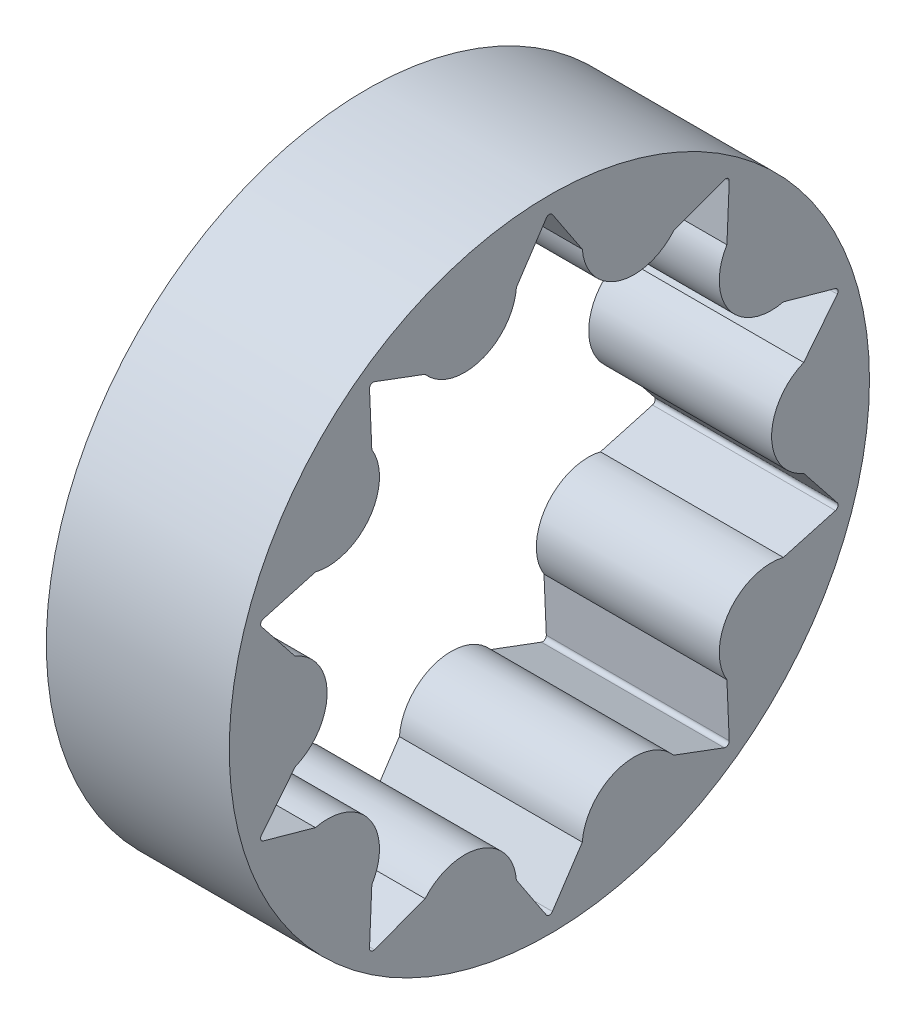
from build123d import *

# Parameters (mm, degrees)
BOSS_EXTRUDE1_DEPTH     = 5.3
CIRPATTERN1_COUNT       = 10
FILLET1_R               = 0.2
FILLET3_R               = 0.2
SKETCH2_R               = 10
SKETCH2_R_2             = 4.05
BOSS_EXTRUDE2_DEPTH     = 16.7
CUT_EXTRUDE1_DEPTH      = 29.341701561
CUT_EXTRUDE1_DEPTH_BACK = 29.341701561
SKETCH2_2_R             = 4.05
SKETCH3_R               = 17.5
BOSS_EXTRUDE3_DEPTH     = 10
SKETCH3_3_R             = 17.5
CUT_EXTRUDE2_DEPTH      = 34.11344138


with BuildPart() as part:
    # Sketch1 → Boss-Extrude1 (new body)
    with BuildSketch(Plane(origin=(0, 0, 0), x_dir=(0, 0, -1), z_dir=(1, 0, 0))):
        with BuildLine():
            Line((0, 0), (9.845402976, 13.551034656))
            Line((9.845402976, 13.551034656), (6.793214092, 12.412684734))
            ThreePointArc((6.793214092, 12.412684734), (3.754556482, 11.555336673), (1.800167381, 14.035023954))
            Line((1.800167381, 14.035023954), (0, 16.75))
            Line((0, 16.75), (0, 0))
        make_face()
    boss_extrude1 = extrude(amount=BOSS_EXTRUDE1_DEPTH)

    # CirPattern1: Boss-Extrude1 ×10 about axis
    cirpattern1_axis = Axis((5.3, 0, 0), (-1, 0, 0))
    for i in range(1, CIRPATTERN1_COUNT):
        add(boss_extrude1.rotate(cirpattern1_axis, i * 360 / CIRPATTERN1_COUNT))

    # Fillet1
    fillet1_edges = [part.edges().sort_by_distance(p)[0] for p in [
        (2.65, 16.75, 0),
    ]]
    fillet(fillet1_edges, radius=FILLET1_R)

    # Fillet3
    fillet3_edges = [part.edges().sort_by_distance(p)[0] for p in [
        (2.65, 13.551034656, 9.845402976),
        (2.65, 5.176034656, 15.930196648),
        (2.65, -5.176034656, 15.930196648),
        (2.65, -13.551034656, 9.845402976),
        (2.65, -16.75, 0),
        (2.65, -13.551034656, -9.845402976),
        (2.65, -5.176034656, -15.930196648),
        (2.65, 5.176034656, -15.930196648),
        (2.65, 13.551034656, -9.845402976),
    ]]
    fillet(fillet3_edges, radius=FILLET3_R)

    # Sketch2 → Boss-Extrude2 (add)
    with BuildSketch(Plane.ZY):
        Circle(SKETCH2_R)
        Circle(SKETCH2_R_2, mode=Mode.SUBTRACT)
    extrude(amount=BOSS_EXTRUDE2_DEPTH)

    # Sketch2<2> → Cut-Extrude1 (cut, two sides: drawn at the far end of the back side and taken through both)
    with BuildSketch(Plane.ZY.offset(-CUT_EXTRUDE1_DEPTH_BACK)):
        Circle(SKETCH2_2_R)
    extrude(amount=CUT_EXTRUDE1_DEPTH + CUT_EXTRUDE1_DEPTH_BACK, mode=Mode.SUBTRACT)

    # Sketch3<3> → Cut-Extrude2 (cut, through all)
    with BuildSketch(Plane(origin=(5.3, 0, 0), x_dir=(0, 0, -1), z_dir=(1, 0, 0))):
        Circle(SKETCH3_3_R)
    extrude(amount=-CUT_EXTRUDE2_DEPTH, mode=Mode.SUBTRACT)


with BuildPart() as body_2:
    # Sketch3 → Boss-Extrude3 (new body)
    with BuildSketch(Plane(origin=(5.3, 0, 0), x_dir=(0, 0, -1), z_dir=(1, 0, 0))):
        Circle(SKETCH3_R)
        with BuildLine():
            Line((-9.562783501, 13.445628382), (-6.793214092, 12.412684734))
            ThreePointArc((-6.793214092, 12.412684734), (-3.754556482, 11.555336673), (-1.800167381, 14.035023954))
            Line((-1.800167381, 14.035023954), (-0.166687705, 16.498604974))
            ThreePointArc((-0.166687705, 16.498604974), (0, 16.588082537), (0.166687705, 16.498604974))
            Line((0.166687705, 16.498604974), (1.800167381, 14.035023954))
            ThreePointArc((1.800167381, 14.035023954), (3.754556482, 11.555336673), (6.793214092, 12.412684734))
            Line((6.793214092, 12.412684734), (9.562783501, 13.445628382))
            ThreePointArc((9.562783501, 13.445628382), (9.750230279, 13.420040677), (9.832489873, 13.249675233))
            Line((9.832489873, 13.249675233), (9.7059461, 10.296461057))
            ThreePointArc((9.7059461, 10.296461057), (9.829556482, 7.141590815), (12.791818675, 6.049121837))
            Line((12.791818675, 6.049121837), (15.639596437, 5.256878748))
            ThreePointArc((15.639596437, 5.256878748), (15.77620399, 5.125999408), (15.742615104, 4.939819893))
            Line((15.742615104, 4.939819893), (13.904383302, 2.625))
            ThreePointArc((13.904383302, 2.625), (12.15, 0), (13.904383302, -2.625))
            Line((13.904383302, -2.625), (15.742615104, -4.939819893))
            ThreePointArc((15.742615104, -4.939819893), (15.77620399, -5.125999408), (15.639596437, -5.256878748))
            Line((15.639596437, -5.256878748), (12.791818675, -6.049121837))
            ThreePointArc((12.791818675, -6.049121837), (9.829556482, -7.141590815), (9.7059461, -10.296461057))
            Line((9.7059461, -10.296461057), (9.832489873, -13.249675233))
            ThreePointArc((9.832489873, -13.249675233), (9.750230279, -13.420040677), (9.562783501, -13.445628382))
            Line((9.562783501, -13.445628382), (6.793214092, -12.412684734))
            ThreePointArc((6.793214092, -12.412684734), (3.754556482, -11.555336673), (1.800167381, -14.035023954))
            Line((1.800167381, -14.035023954), (0.166687705, -16.498604974))
            ThreePointArc((0.166687705, -16.498604974), (0, -16.588082537), (-0.166687705, -16.498604974))
            Line((-0.166687705, -16.498604974), (-1.800167381, -14.035023954))
            ThreePointArc((-1.800167381, -14.035023954), (-3.754556482, -11.555336673), (-6.793214092, -12.412684734))
            Line((-6.793214092, -12.412684734), (-9.562783501, -13.445628382))
            ThreePointArc((-9.562783501, -13.445628382), (-9.750230279, -13.420040677), (-9.832489873, -13.249675233))
            Line((-9.832489873, -13.249675233), (-9.7059461, -10.296461057))
            ThreePointArc((-9.7059461, -10.296461057), (-9.829556482, -7.141590815), (-12.791818675, -6.049121837))
            Line((-12.791818675, -6.049121837), (-15.639596437, -5.256878748))
            ThreePointArc((-15.639596437, -5.256878748), (-15.77620399, -5.125999408), (-15.742615104, -4.939819893))
            Line((-15.742615104, -4.939819893), (-13.904383302, -2.625))
            ThreePointArc((-13.904383302, -2.625), (-12.15, 0), (-13.904383302, 2.625))
            Line((-13.904383302, 2.625), (-15.742615104, 4.939819893))
            ThreePointArc((-15.742615104, 4.939819893), (-15.77620399, 5.125999408), (-15.639596437, 5.256878748))
            Line((-15.639596437, 5.256878748), (-12.791818675, 6.049121837))
            ThreePointArc((-12.791818675, 6.049121837), (-9.829556482, 7.141590815), (-9.7059461, 10.296461057))
            Line((-9.7059461, 10.296461057), (-9.832489873, 13.249675233))
            ThreePointArc((-9.832489873, 13.249675233), (-9.750230279, 13.420040677), (-9.562783501, 13.445628382))
        make_face(mode=Mode.SUBTRACT)
    extrude(amount=BOSS_EXTRUDE3_DEPTH)


solid = body_2.part
